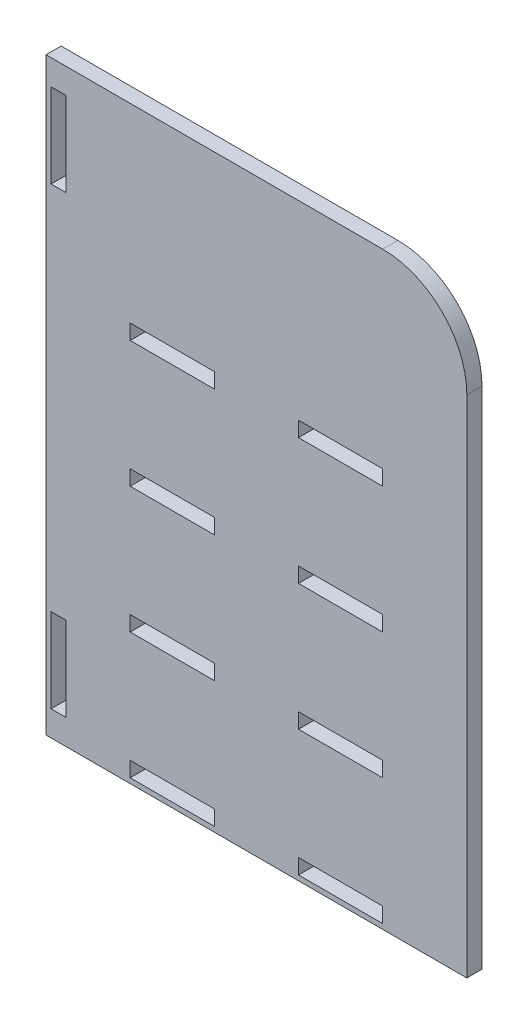
from build123d import *

# Parameters (mm, degrees)
SKETCH1_W           = 100
SKETCH1_H           = 18
SKETCH1_W_2         = 18
SKETCH1_H_2         = 100
BOSS_EXTRUDE1_DEPTH = 18


with BuildPart() as part:
    # Sketch1 → Boss-Extrude1 (new body)
    with BuildSketch(Plane.XY):
        with BuildLine():
            Line((-817.41132124, 1115.015948799), (-417.41132124, 1115.015948799))
            ThreePointArc((-417.41132124, 1115.015948799), (-346.700643121, 1085.726626917), (-317.41132124, 1015.015948799))
            Line((-317.41132124, 1015.015948799), (-317.41132124, 415.015948799))
            Line((-317.41132124, 415.015948799), (-817.41132124, 415.015948799))
            Line((-817.41132124, 415.015948799), (-817.41132124, 1115.015948799))
        make_face()
        with Locations((-667.41132124, 430.015948799)):
            Rectangle(SKETCH1_W, SKETCH1_H, mode=Mode.SUBTRACT)
        with Locations((-467.41132124, 580.015948799)):
            Rectangle(SKETCH1_W, SKETCH1_H, mode=Mode.SUBTRACT)
        with Locations((-467.41132124, 430.015948799)):
            Rectangle(SKETCH1_W, SKETCH1_H, mode=Mode.SUBTRACT)
        with Locations((-667.41132124, 580.015948799)):
            Rectangle(SKETCH1_W, SKETCH1_H, mode=Mode.SUBTRACT)
        with Locations((-467.41132124, 730.015948799)):
            Rectangle(SKETCH1_W, SKETCH1_H, mode=Mode.SUBTRACT)
        with Locations((-667.41132124, 730.015948799)):
            Rectangle(SKETCH1_W, SKETCH1_H, mode=Mode.SUBTRACT)
        with Locations((-467.41132124, 880.015948799)):
            Rectangle(SKETCH1_W, SKETCH1_H, mode=Mode.SUBTRACT)
        with Locations((-667.41132124, 880.015948799)):
            Rectangle(SKETCH1_W, SKETCH1_H, mode=Mode.SUBTRACT)
        with Locations((-802.41132124, 495.015948799)):
            Rectangle(SKETCH1_W_2, SKETCH1_H_2, mode=Mode.SUBTRACT)
        with Locations((-802.41132124, 1035.015948799)):
            Rectangle(SKETCH1_W_2, SKETCH1_H_2, mode=Mode.SUBTRACT)
    extrude(amount=BOSS_EXTRUDE1_DEPTH)


solid = part.part
